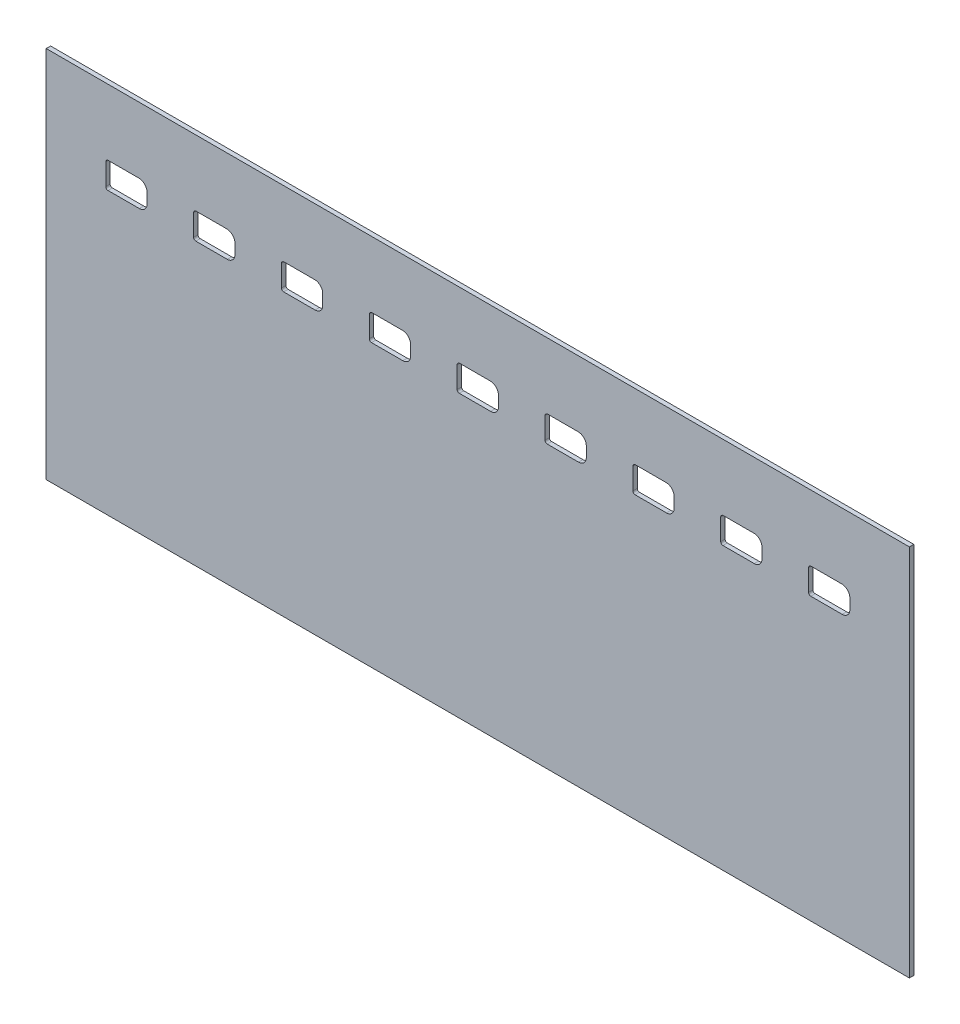
from build123d import *

# Parameters (mm, degrees)
MODEL_W             = 393
MODEL_H             = 170
BOSS_EXTRUDE1_DEPTH = 2
CUT_EXTRUDE1_DEPTH  = 215.105698196


with BuildPart() as part:
    # Model → Boss-Extrude1 (new body)
    with BuildSketch(Plane.XY):
        Rectangle(MODEL_W, MODEL_H)
    extrude(amount=BOSS_EXTRUDE1_DEPTH)

    # Sketch1 → Cut-Extrude1 (cut, through all)
    with BuildSketch(Plane.XY.offset(2)):
        with BuildLine():
            Line((-154.125, 43.1), (-168.4, 43.1))
            ThreePointArc((-168.4, 43.1), (-169.107106781, 43.392893219), (-169.4, 44.1))
            Line((-169.4, 44.1), (-169.4, 53.8))
            ThreePointArc((-169.4, 53.8), (-169.048528137, 54.648528137), (-168.2, 55))
            Line((-168.2, 55), (-154.325, 55))
            ThreePointArc((-154.325, 55), (-151.69102724, 53.90897276), (-150.6, 51.275))
            Line((-150.6, 51.275), (-150.6, 46.625))
            ThreePointArc((-150.6, 46.625), (-151.632448596, 44.132448596), (-154.125, 43.1))
        make_face()
        with BuildLine():
            Line((-114.125, 43.1), (-128.4, 43.1))
            ThreePointArc((-128.4, 43.1), (-129.107106781, 43.392893219), (-129.4, 44.1))
            Line((-129.4, 44.1), (-129.4, 53.8))
            ThreePointArc((-129.4, 53.8), (-129.048528137, 54.648528137), (-128.2, 55))
            Line((-128.2, 55), (-114.325, 55))
            ThreePointArc((-114.325, 55), (-111.69102724, 53.90897276), (-110.6, 51.275))
            Line((-110.6, 51.275), (-110.6, 46.625))
            ThreePointArc((-110.6, 46.625), (-111.632448596, 44.132448596), (-114.125, 43.1))
        make_face()
        with BuildLine():
            Line((-74.125, 43.1), (-88.4, 43.1))
            ThreePointArc((-88.4, 43.1), (-89.107106781, 43.392893219), (-89.4, 44.1))
            Line((-89.4, 44.1), (-89.4, 53.8))
            ThreePointArc((-89.4, 53.8), (-89.048528137, 54.648528137), (-88.2, 55))
            Line((-88.2, 55), (-74.325, 55))
            ThreePointArc((-74.325, 55), (-71.69102724, 53.90897276), (-70.6, 51.275))
            Line((-70.6, 51.275), (-70.6, 46.625))
            ThreePointArc((-70.6, 46.625), (-71.632448596, 44.132448596), (-74.125, 43.1))
        make_face()
        with BuildLine():
            Line((-34.125, 43.1), (-48.4, 43.1))
            ThreePointArc((-48.4, 43.1), (-49.107106781, 43.392893219), (-49.4, 44.1))
            Line((-49.4, 44.1), (-49.4, 53.8))
            ThreePointArc((-49.4, 53.8), (-49.048528137, 54.648528137), (-48.2, 55))
            Line((-48.2, 55), (-34.325, 55))
            ThreePointArc((-34.325, 55), (-31.69102724, 53.90897276), (-30.6, 51.275))
            Line((-30.6, 51.275), (-30.6, 46.625))
            ThreePointArc((-30.6, 46.625), (-31.632448596, 44.132448596), (-34.125, 43.1))
        make_face()
        with BuildLine():
            Line((5.875, 43.1), (-8.4, 43.1))
            ThreePointArc((-8.4, 43.1), (-9.107106781, 43.392893219), (-9.4, 44.1))
            Line((-9.4, 44.1), (-9.4, 53.8))
            ThreePointArc((-9.4, 53.8), (-9.048528137, 54.648528137), (-8.2, 55))
            Line((-8.2, 55), (5.675, 55))
            ThreePointArc((5.675, 55), (8.30897276, 53.90897276), (9.4, 51.275))
            Line((9.4, 51.275), (9.4, 46.625))
            ThreePointArc((9.4, 46.625), (8.367551404, 44.132448596), (5.875, 43.1))
        make_face()
        with BuildLine():
            Line((45.875, 43.1), (31.6, 43.1))
            ThreePointArc((31.6, 43.1), (30.892893219, 43.392893219), (30.6, 44.1))
            Line((30.6, 44.1), (30.6, 53.8))
            ThreePointArc((30.6, 53.8), (30.951471863, 54.648528137), (31.8, 55))
            Line((31.8, 55), (45.675, 55))
            ThreePointArc((45.675, 55), (48.30897276, 53.90897276), (49.4, 51.275))
            Line((49.4, 51.275), (49.4, 46.625))
            ThreePointArc((49.4, 46.625), (48.367551404, 44.132448596), (45.875, 43.1))
        make_face()
        with BuildLine():
            Line((85.875, 43.1), (71.6, 43.1))
            ThreePointArc((71.6, 43.1), (70.892893219, 43.392893219), (70.6, 44.1))
            Line((70.6, 44.1), (70.6, 53.8))
            ThreePointArc((70.6, 53.8), (70.951471863, 54.648528137), (71.8, 55))
            Line((71.8, 55), (85.675, 55))
            ThreePointArc((85.675, 55), (88.30897276, 53.90897276), (89.4, 51.275))
            Line((89.4, 51.275), (89.4, 46.625))
            ThreePointArc((89.4, 46.625), (88.367551404, 44.132448596), (85.875, 43.1))
        make_face()
        with BuildLine():
            Line((125.875, 43.1), (111.6, 43.1))
            ThreePointArc((111.6, 43.1), (110.892893219, 43.392893219), (110.6, 44.1))
            Line((110.6, 44.1), (110.6, 53.8))
            ThreePointArc((110.6, 53.8), (110.951471863, 54.648528137), (111.8, 55))
            Line((111.8, 55), (125.675, 55))
            ThreePointArc((125.675, 55), (128.30897276, 53.90897276), (129.4, 51.275))
            Line((129.4, 51.275), (129.4, 46.625))
            ThreePointArc((129.4, 46.625), (128.367551404, 44.132448596), (125.875, 43.1))
        make_face()
        with BuildLine():
            Line((165.875, 43.1), (151.6, 43.1))
            ThreePointArc((151.6, 43.1), (150.892893219, 43.392893219), (150.6, 44.1))
            Line((150.6, 44.1), (150.6, 53.8))
            ThreePointArc((150.6, 53.8), (150.951471863, 54.648528137), (151.8, 55))
            Line((151.8, 55), (165.675, 55))
            ThreePointArc((165.675, 55), (168.30897276, 53.90897276), (169.4, 51.275))
            Line((169.4, 51.275), (169.4, 46.625))
            ThreePointArc((169.4, 46.625), (168.367551404, 44.132448596), (165.875, 43.1))
        make_face()
    extrude(amount=-CUT_EXTRUDE1_DEPTH, mode=Mode.SUBTRACT)


solid = part.part
